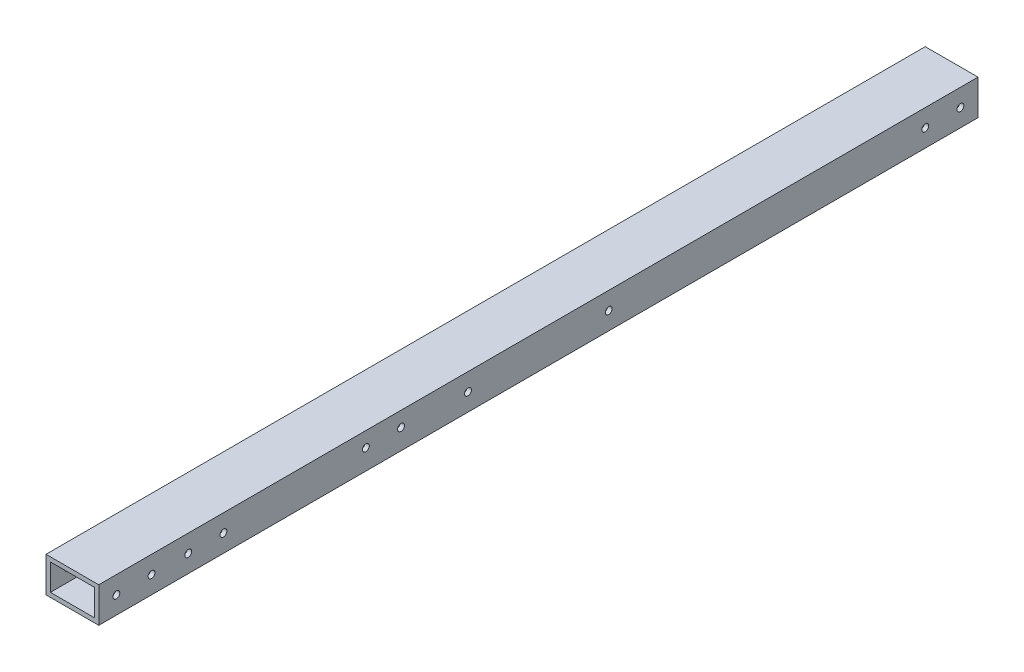
from build123d import *

# Parameters (mm, degrees)
BOSS_EXTRUDE1_DEPTH      = 317.499999
BOSS_EXTRUDE1_DEPTH_BACK = 317.499999
SKETCH3_W                = 38.1
SKETCH3_H                = 25.4
SKETCH3_W_2              = 31.75
SKETCH3_H_2              = 19.05
F_10_CLEARANCE_HOLE2_D   = 4.9784
F_10_CLEARANCE_HOLE4_D   = 4.9784
F_10_CLEARANCE_HOLE3_D   = 4.9784


with BuildPart() as part:
    # Sketch3 → Boss-Extrude1 (new, two sides: drawn at the far end of the back side and taken through both)
    with BuildSketch(Plane.XY.offset(-BOSS_EXTRUDE1_DEPTH_BACK)):
        Rectangle(SKETCH3_W, SKETCH3_H)
        Rectangle(SKETCH3_W_2, SKETCH3_H_2, mode=Mode.SUBTRACT)
    extrude(amount=BOSS_EXTRUDE1_DEPTH + BOSS_EXTRUDE1_DEPTH_BACK)

    # #10 Clearance Hole2 (through all)
    with Locations(Plane.ZY.offset(19.05)):
        with Locations((-304.800000508, 0), (-279.400000508, 0), (279.399999492, 0), (304.799999492, 0)):
            Hole(F_10_CLEARANCE_HOLE2_D / 2)

    # #10 Clearance Hole4 (through all)
    with Locations(Plane(origin=(19.05, 0, 0), x_dir=(0, 0, -1), z_dir=(1, 0, 0))):
        with Locations((-252.857000506, 8e-09), (-227.457000506, 1.1e-08), (-124.587000507, 1.943404818), (-99.187000507, 1.943404821)):
            Hole(F_10_CLEARANCE_HOLE4_D / 2)

    # #10 Clearance Hole3 (through all)
    with Locations(Plane.ZY.offset(19.05)):
        with Locations((-50.8, 0), (50.8, 0)):
            Hole(F_10_CLEARANCE_HOLE3_D / 2)


solid = part.part
